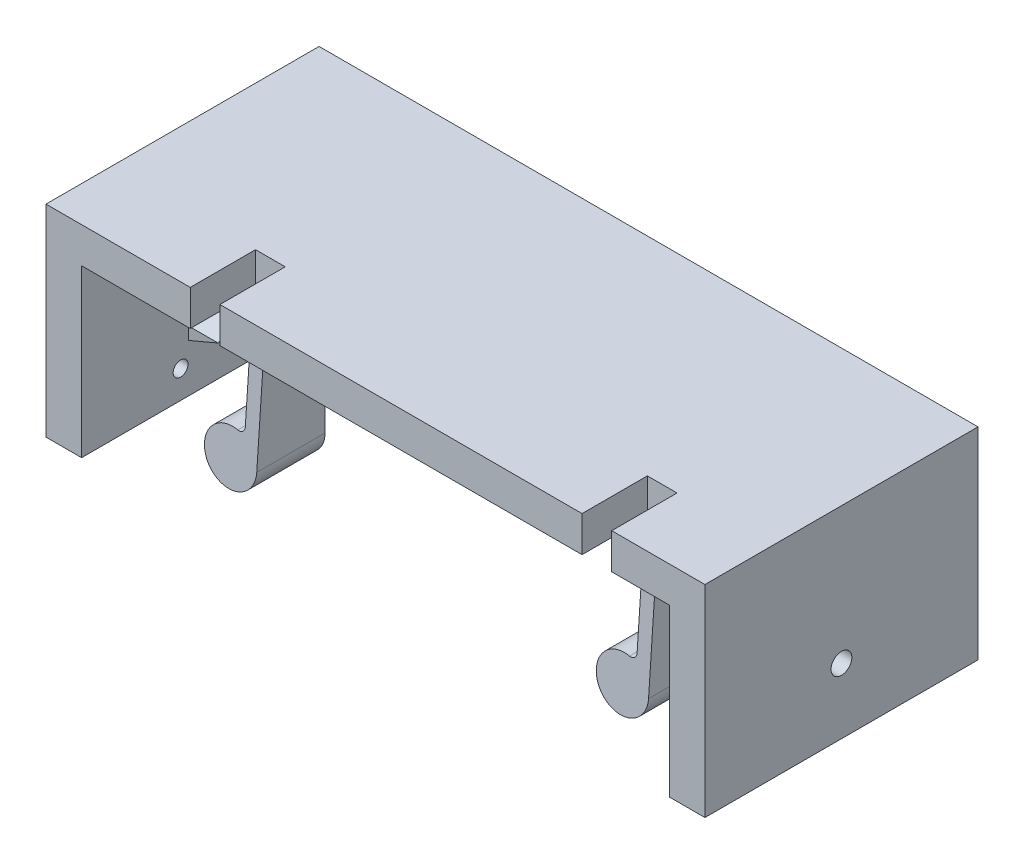
from build123d import *

# Parameters (mm, degrees)
BOSS_EXTRUDE1_DEPTH       = 23
CUT_EXTRUDE1_REACH        = 120.347
SKETCH2_R                 = 1.25
CUT_EXTRUDE2_REACH        = 114.739
SKETCH3_R                 = 1.75
BOSS_EXTRUDE2_START       = -11.4
BOSS_EXTRUDE2_DEPTH       = 11.5
LPATTERN1_COUNT           = 2
LPATTERN1_PITCH           = 66
DRAFT1_ANGLE              = 4
MIRROR1_START             = -11.4
MIRROR1_COPY_1_DEPTH      = 11.5
DRAFT1_OF_MIRROR1_2_ANGLE = 4
SKETCH5_W                 = 5
SKETCH5_H                 = 6
CUT_EXTRUDE3_DEPTH        = 11


with BuildPart() as part:
    # Sketch1 → Boss-Extrude1 (new, symmetric)
    with BuildSketch(Plane.XY):
        Polygon((-62, 0), (49, 0), (49, -34), (43, -34), (43, -6), (-56, -6), (-56, -34), (-62, -34), align=None)
    extrude(amount=BOSS_EXTRUDE1_DEPTH, both=True)

    # Sketch2 → Cut-Extrude1 (cut, up to next)
    with BuildSketch(Plane.ZY.offset(62), mode=Mode.PRIVATE) as cut_extrude1_sk1:
        with Locations((-6.328605692, -16.671394308)):
            Circle(SKETCH2_R)
    cut_extrude1_tool1 = extrude(cut_extrude1_sk1.sketch, amount=-CUT_EXTRUDE1_REACH, mode=Mode.PRIVATE) & part.part
    # Sketch2 → Cut-Extrude1 (cut, up to next)
    with BuildSketch(Plane.ZY.offset(62), mode=Mode.PRIVATE) as cut_extrude1_sk2:
        with Locations((6.328605692, -16.671394308)):
            Circle(SKETCH2_R)
    cut_extrude1_tool2 = extrude(cut_extrude1_sk2.sketch, amount=-CUT_EXTRUDE1_REACH, mode=Mode.PRIVATE) & part.part
    # Sketch2 → Cut-Extrude1 (cut, up to next)
    with BuildSketch(Plane.ZY.offset(62), mode=Mode.PRIVATE) as cut_extrude1_sk3:
        with Locations((6.328605692, -29.328605692)):
            Circle(SKETCH2_R)
    cut_extrude1_tool3 = extrude(cut_extrude1_sk3.sketch, amount=-CUT_EXTRUDE1_REACH, mode=Mode.PRIVATE) & part.part
    # Sketch2 → Cut-Extrude1 (cut, up to next)
    with BuildSketch(Plane.ZY.offset(62), mode=Mode.PRIVATE) as cut_extrude1_sk4:
        with Locations((-6.328605692, -29.328605692)):
            Circle(SKETCH2_R)
    cut_extrude1_tool4 = extrude(cut_extrude1_sk4.sketch, amount=-CUT_EXTRUDE1_REACH, mode=Mode.PRIVATE) & part.part
    # Sketch2 → Cut-Extrude1 (cut, up to next)
    with BuildSketch(Plane.ZY.offset(62), mode=Mode.PRIVATE) as cut_extrude1_sk5:
        Polygon((-5, -20.113248654), (-5, -25.886751346), (0, -28.773502692), (5, -25.886751346), (5, -20.113248654), (0, -17.226497308), align=None)
    cut_extrude1_tool5 = extrude(cut_extrude1_sk5.sketch, amount=-CUT_EXTRUDE1_REACH, mode=Mode.PRIVATE) & part.part
    add(cut_extrude1_tool1.solids().sort_by_distance((-62, -16.671394, -6.328606))[0], mode=Mode.SUBTRACT)
    add(cut_extrude1_tool2.solids().sort_by_distance((-62, -16.671394, 6.328606))[0], mode=Mode.SUBTRACT)
    add(cut_extrude1_tool3.solids().sort_by_distance((-62, -29.328606, 6.328606))[0], mode=Mode.SUBTRACT)
    add(cut_extrude1_tool4.solids().sort_by_distance((-62, -29.328606, -6.328606))[0], mode=Mode.SUBTRACT)
    add(cut_extrude1_tool5.solids().sort_by_distance((-62, -23, 0))[0], mode=Mode.SUBTRACT)

    # Sketch3 → Cut-Extrude2 (cut, up to next)
    with BuildSketch(Plane.ZY.offset(-43), mode=Mode.PRIVATE) as cut_extrude2_sk1:
        with Locations((0, -23)):
            Circle(SKETCH3_R)
    cut_extrude2_tool1 = extrude(cut_extrude2_sk1.sketch, amount=-CUT_EXTRUDE2_REACH, mode=Mode.PRIVATE) & part.part
    add(cut_extrude2_tool1.solids().sort_by_distance((43, -23, 0))[0], mode=Mode.SUBTRACT)

    # Sketch4 → Boss-Extrude2 (add)
    with BuildSketch(Plane(origin=(0, 0, 0), x_dir=(-1, 0, 0), z_dir=(0, 0, -1)).offset(BOSS_EXTRUDE2_START)):
        with BuildLine():
            Line((28.9, -16.213224045), (28.9, -6))
            Line((28.9, -6), (26.6, -6))
            Line((26.6, -6), (26.6, -21.5))
            ThreePointArc((26.6, -21.5), (34.4134809, -24.276355191), (30.103703704, -17.192256629))
            ThreePointArc((30.103703704, -17.192256629), (29.269010184, -16.989015158), (28.9, -16.213224045))
        make_face()
    boss_extrude2 = extrude(amount=-BOSS_EXTRUDE2_DEPTH)

    # LPattern1: Boss-Extrude2 ×2
    with Locations(*[(i * LPATTERN1_PITCH, 0, 0) for i in range(1, LPATTERN1_COUNT)]):
        add(boss_extrude2)

    # Draft1
    draft1_faces = [part.faces().sort_by_distance(p)[0] for p in [
        (36.075013094, -18.535245668, 22.9),
        (-29.924986906, -18.535245668, 22.9),
    ]]
    draft(draft1_faces, Plane.ZX.offset(-21.5), DRAFT1_ANGLE)

    # Mirror1: Boss-Extrude2 across plane
    add(boss_extrude2.mirror(Plane.XY))

    # Mirror1 copy 1 sketch → Mirror1 copy 1 (add)
    with BuildSketch(Plane(origin=(66, 0, 0), x_dir=(-1, 0, 0), z_dir=(0, 0, 1)).offset(MIRROR1_START)):
        with BuildLine():
            Line((28.9, 16.213224045), (28.9, 6))
            Line((28.9, 6), (26.6, 6))
            Line((26.6, 6), (26.6, 21.5))
            ThreePointArc((26.6, 21.5), (34.4134809, 24.276355191), (30.103703704, 17.192256629))
            ThreePointArc((30.103703704, 17.192256629), (29.269010184, 16.989015158), (28.9, 16.213224045))
        make_face()
    extrude(amount=-MIRROR1_COPY_1_DEPTH)

    # Draft1 of Mirror1 2
    draft1_of_mirror1_2_faces = [part.faces().sort_by_distance(p)[0] for p in [
        (36.075013094, -18.535245668, -22.9),
        (-29.924986906, -18.535245668, -22.9),
    ]]
    draft(draft1_of_mirror1_2_faces, Plane(origin=(0, -21.5, 0), x_dir=(0, 0, -1), z_dir=(0, 1, 0)), DRAFT1_OF_MIRROR1_2_ANGLE)

    # Sketch5 → Cut-Extrude3 (cut)
    with BuildSketch(Plane.XY.offset(23)):
        with Locations((-35.2, -3)):
            Rectangle(SKETCH5_W, SKETCH5_H)
        with Locations((30.8, -3)):
            Rectangle(SKETCH5_W, SKETCH5_H)
    extrude(amount=-CUT_EXTRUDE3_DEPTH, mode=Mode.SUBTRACT)


solid = part.part
